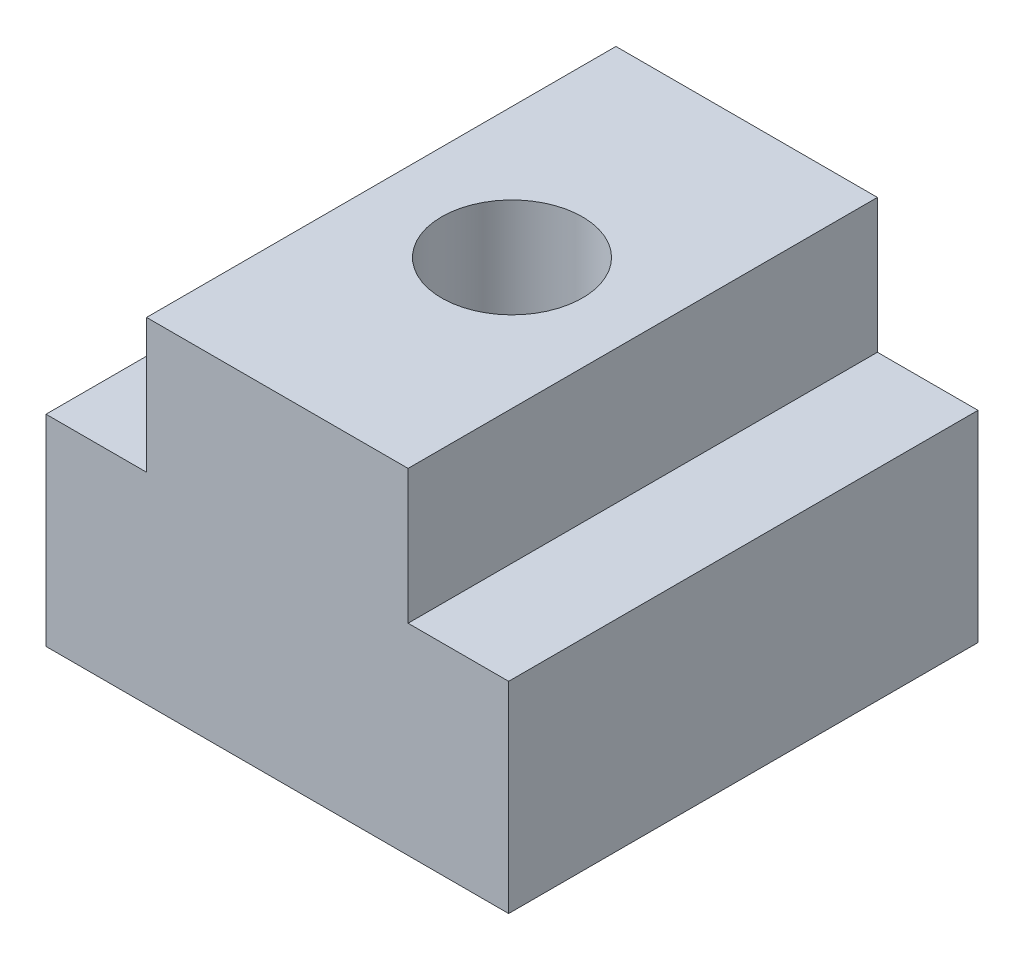
from build123d import *

# Parameters (mm, degrees)
ESQUISSE1_W             = 13.8
ESQUISSE1_H             = 6
BOSS_EXTRU_1_DEPTH      = 14
ESQUISSE2_W             = 7.8
ESQUISSE2_H             = 4
BOSS_EXTRU_2_DEPTH      = 14
ESQUISSE3_R             = 2.1
ENL_V_MAT_EXTRU_1_DEPTH = 23.05538483


with BuildPart() as part:
    # Esquisse1 → Boss.-Extru.1 (new body)
    with BuildSketch(Plane.XY):
        with Locations((6.9, 3)):
            Rectangle(ESQUISSE1_W, ESQUISSE1_H)
    extrude(amount=BOSS_EXTRU_1_DEPTH)

    # Esquisse2 → Boss.-Extru.2 (add)
    with BuildSketch(Plane.XY.offset(14)):
        with Locations((6.9, 8)):
            Rectangle(ESQUISSE2_W, ESQUISSE2_H)
    extrude(amount=-BOSS_EXTRU_2_DEPTH)

    # Esquisse3 → Enlèv. mat.-Extru.1 (cut, through all)
    with BuildSketch(Plane(origin=(0, 10, 0), x_dir=(1, 0, 0), z_dir=(0, 1, 0))):
        with Locations(Location((6.9, -7, 0), (0, 0, 180))):
            Circle(ESQUISSE3_R)
    extrude(amount=-ENL_V_MAT_EXTRU_1_DEPTH, mode=Mode.SUBTRACT)


solid = part.part
